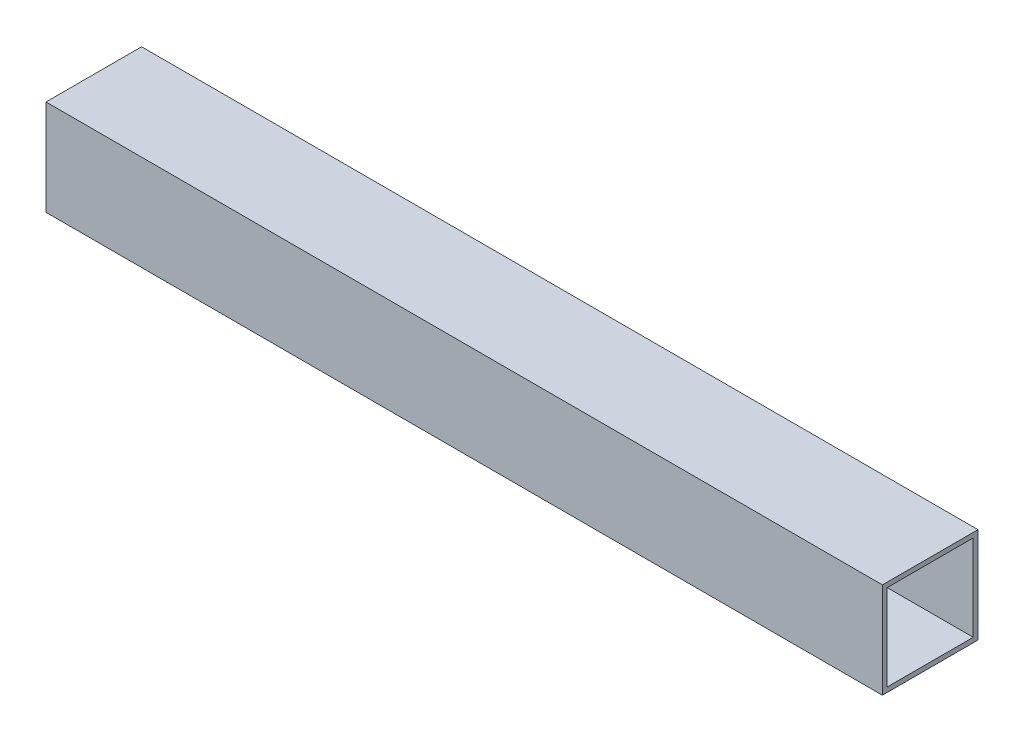
from build123d import *

# Parameters (mm, degrees)
SKETCH1_W           = 40
SKETCH1_H           = 40
SKETCH1_W_2         = 36
SKETCH1_H_2         = 36
BOSS_EXTRUDE1_DEPTH = 360
CUT_EXTRUDE1_START  = 360
SKETCH1_2_W         = 40
SKETCH1_2_H         = 40
SKETCH1_2_W_2       = 36
SKETCH1_2_H_2       = 36
CUT_EXTRUDE1_DEPTH  = 370


with BuildPart() as part:
    # Sketch1 → Boss-Extrude1 (new, symmetric)
    with BuildSketch(Plane(origin=(0, 0, 0), x_dir=(0, 0, -1), z_dir=(1, 0, 0))):
        Rectangle(SKETCH1_W, SKETCH1_H)
        Rectangle(SKETCH1_W_2, SKETCH1_H_2, mode=Mode.SUBTRACT)
    extrude(amount=BOSS_EXTRUDE1_DEPTH, both=True)

    # Sketch1<2> → Cut-Extrude1 (cut)
    with BuildSketch(Plane(origin=(0, 0, 0), x_dir=(0, 0, -1), z_dir=(1, 0, 0)).offset(CUT_EXTRUDE1_START)):
        Rectangle(SKETCH1_2_W, SKETCH1_2_H)
        Rectangle(SKETCH1_2_W_2, SKETCH1_2_H_2, mode=Mode.SUBTRACT)
    extrude(amount=-CUT_EXTRUDE1_DEPTH, mode=Mode.SUBTRACT)


solid = part.part
